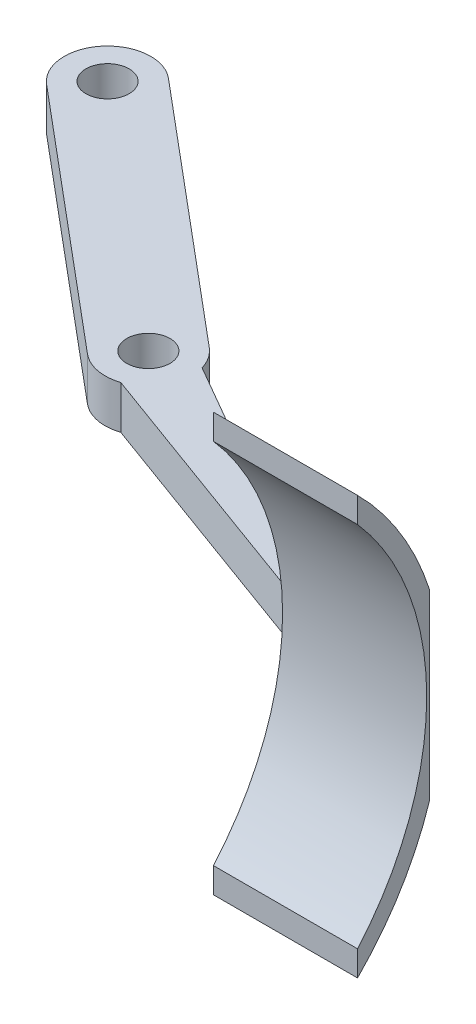
from build123d import *

# Parameters (mm, degrees)
SKETCH_1_R          = 1.5
SKETCH_1_R_2        = 1.5000000000000007
EXTRUDE_1_DEPTH     = 3
EXTRUDE_2_DEPTH     = 3
EXTRUDE_3_DEPTH     = 10
EXTRUDE_4_DEPTH     = 3
SKETCH_5_W          = 5.158542288566252
SKETCH_5_H          = 3
EXTRUDE_5_DEPTH     = 2
SKETCH_6_W          = 7
SKETCH_6_H          = 3
EXTRUDE_6_DEPTH     = 2
CHAMFER_1_SIZE      = 3
SKETCH_7_W          = 66.6001387822102
SKETCH_7_H          = 28.97194366122671
CUT_EXTRUDE_1_DEPTH = 80
EXTRUDE_8_DEPTH     = 3
SKETCH_10_R         = 1.4999999999999987
SKETCH_10_R_2       = 1.5000000000000007
CUT_EXTRUDE_2_DEPTH = 3


with BuildPart() as part:
    # 草图1 → 凸台-拉伸1 (new body)
    with BuildSketch(Plane(origin=(0, 0, 0), x_dir=(1, 0, 0), z_dir=(0, 1, 0))):
        with BuildLine():
            Line((0, 2.999999999999999), (25, 2.999999999999999))
            ThreePointArc((25, 2.999999999999999), (28, 0), (25, -2.999999999999999))
            Line((25, -2.999999999999999), (0, -2.999999999999999))
            ThreePointArc((0, -2.999999999999999), (-2.999999999999997, 3.7e-16), (0, 2.999999999999999))
        make_face()
        with Locations(Location((0, 0, 0), (0, 0, 270))):
            Circle(SKETCH_1_R, mode=Mode.SUBTRACT)
        with Locations(Location((25, 0, 0), (0, 0, 270))):
            Circle(SKETCH_1_R_2, mode=Mode.SUBTRACT)
    extrude(amount=EXTRUDE_1_DEPTH)

    # 草图2 → 凸台-拉伸2 (add)
    with BuildSketch(Plane.XZ):
        with BuildLine():
            Line((26.499999999999986, -2.5980762113533244), (46.006930637676454, 8.664255443372392))
            Line((46.006930637676454, 8.664255443372392), (56.006930637676454, 8.664255443372392))
            Line((56.006930637676454, 8.664255443372392), (56.00693063767646, 9.66425544337239))
            Line((56.00693063767646, 9.66425544337239), (46.006930637676476, 9.66425544337241))
            Line((46.006930637676476, 9.66425544337241), (26.942439211337344, 2.7051474006582077))
            Line((26.942439211337344, 2.7051474006582077), (25.518180954342487, 2.9549092200195775))
            ThreePointArc((25.518180954342487, 2.9549092200195775), (27.954179309279922, 0.522326151578114), (26.499999999999986, -2.5980762113533244))
        make_face()
    extrude(amount=-EXTRUDE_2_DEPTH)

    # 草图3 → 凸台-拉伸3 (add)
    with BuildSketch(Plane(origin=(56.0069306376764, 0, -3.8863e-13), x_dir=(-6.94e-15, 0, -1), z_dir=(1, 0, -6.94e-15))):
        with BuildLine():
            Line((-14.664255443372781, 16), (-14.664255443372781, 14.245195173083879))
            ThreePointArc((-14.664255443372781, 14.245195173083879), (-9.864255443372706, 1.5000000000000009), (-14.664255443372777, -11.24519517308388))
            Line((-14.664255443372777, -11.24519517308388), (-14.664255443372777, -13))
            ThreePointArc((-14.664255443372777, -13), (-8.66425544337271, 1.5000000000000009), (-14.664255443372781, 16))
        make_face()
    extrude(amount=-EXTRUDE_3_DEPTH)

    # 草图4 → 凸台-拉伸4 (add)
    with BuildSketch(Plane(origin=(0, 3, 0), x_dir=(1, 0, 0), z_dir=(0, 1, 0))):
        Polygon((38.75296926264814, -4.476178890808707), (51.00693063767646, -8.719151204865875), (46.006930637676454, -8.664255443372392), align=None)
    extrude(amount=-EXTRUDE_4_DEPTH)

    # 草图5 → 凸台-拉伸5 (add)
    with BuildSketch(Plane(origin=(0, 0, 8.664255443372392), x_dir=(-1, 0, 0), z_dir=(0, 0, -1))):
        with Locations((-53.42765949339333, 1.5)):
            Rectangle(SKETCH_5_W, SKETCH_5_H)
    extrude(amount=EXTRUDE_5_DEPTH)

    # 草图6 → 凸台-拉伸6 (add)
    with BuildSketch(Plane(origin=(0, 0, 6.664255443372392), x_dir=(-1, 0, 0), z_dir=(0, 0, -1))):
        with Locations((-47.3483883491102, 1.5)):
            Rectangle(SKETCH_6_W, SKETCH_6_H)
    extrude(amount=-EXTRUDE_6_DEPTH)

    # 倒角1
    chamfer_1_edges = [part.edges().sort_by_distance(p)[0] for p in [
        (56.006930637676454, 1.5, 6.664255443372392),
    ]]
    chamfer(chamfer_1_edges, length=CHAMFER_1_SIZE)

    # 草图7 → 切除-拉伸1 (cut)
    with BuildSketch(Plane.XZ):
        with Locations((-6.222464944833996, 7.620791926380881)):
            Rectangle(SKETCH_7_W, SKETCH_7_H)
    extrude(amount=-CUT_EXTRUDE_1_DEPTH, mode=Mode.SUBTRACT)

    # 草图8 → 凸台-拉伸8 (add)
    with BuildSketch(Plane.XZ):
        with BuildLine():
            Line((29.005967275330715, -2.053188022146578), (11.386945083594192, -16.83730304493695))
            ThreePointArc((11.386945083594192, -16.83730304493695), (7.160448925177645, -16.46753254463963), (7.530219425474969, -12.241036386223078))
            Line((7.530219425474969, -12.241036386223078), (25.14924161721149, 2.5430786365672917))
            ThreePointArc((25.14924161721149, 2.5430786365672917), (29.37573777562804, 2.173308136269972), (29.005967275330715, -2.053188022146578))
        make_face()
    extrude(amount=-EXTRUDE_8_DEPTH)

    # 草图10 → 切除-拉伸2 (cut)
    with BuildSketch(Plane(origin=(0, 3, 0), x_dir=(1, 0, 0), z_dir=(0, 1, 0))):
        with Locations(Location((9.458582254534583, 14.539169715580016, 0), (0, 0, 270))):
            Circle(SKETCH_10_R)
        with Locations(Location((27.077604446271103, -0.24494530721035945, 0), (0, 0, 270))):
            Circle(SKETCH_10_R_2)
    extrude(amount=-CUT_EXTRUDE_2_DEPTH, mode=Mode.SUBTRACT)


solid = part.part
